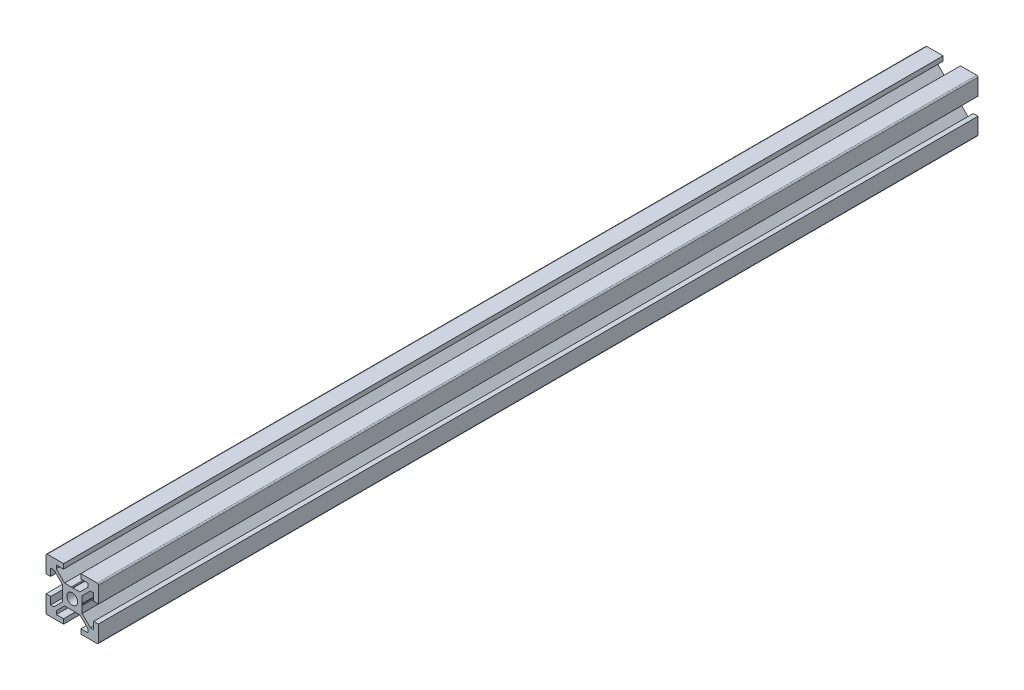
from build123d import *
from build123d.topology import SkipClean

# Parameters (mm, degrees)
SKETCH1_R            = 2.05
BOSS_EXTRUDE1_DEPTH  = 157.75
FILLET1_R            = 0.5
SKETCH2_R            = 2.75
CUT_EXTRUDE1_DEPTH   = 160.326904508
FILLET1_OF_MIRROR1_R = 0.5
SKETCH3_R            = 2.05
BOSS_EXTRUDE2_DEPTH  = 20


with BuildPart() as part:
    # Sketch1 → Boss-Extrude1 (new body)
    with BuildSketch(Plane.XY):
        Polygon((-3.3, 10), (-3.3, 8.2), (-6.08, 8.2), (-6.08, 6.928528137), (-2.931471863, 3.78), (-0.34, 3.78), (0, 3.66), (0.34, 3.78), (2.931471863, 3.78), (6.08, 6.928528137), (6.08, 8.2), (3.3, 8.2), (3.3, 10), (10, 10), (10, 3.3), (8.2, 3.3), (8.2, 6.08), (6.928528137, 6.08), (3.78, 2.931471863), (3.78, 0.34), (3.66, 0), (3.78, -0.34), (3.78, -2.931471863), (6.928528137, -6.08), (8.2, -6.08), (8.2, -3.3), (10, -3.3), (10, -10), (3.3, -10), (3.3, -8.2), (6.08, -8.2), (6.08, -6.928528137), (2.931471863, -3.78), (0.34, -3.78), (0, -3.66), (-0.34, -3.78), (-2.931471863, -3.78), (-6.08, -6.928528137), (-6.08, -8.2), (-3.3, -8.2), (-3.3, -10), (-10, -10), (-10, -3.3), (-8.2, -3.3), (-8.2, -6.08), (-6.928528137, -6.08), (-3.78, -2.931471863), (-3.78, -0.34), (-3.66, 0), (-3.78, 0.34), (-3.78, 2.931471863), (-6.928528137, 6.08), (-8.2, 6.08), (-8.2, 3.3), (-10, 3.3), (-10, 10), align=None)
        Circle(SKETCH1_R, mode=Mode.SUBTRACT)
    boss_extrude1 = extrude(amount=BOSS_EXTRUDE1_DEPTH)

    # Fillet1
    fillet1_edges = [part.edges().sort_by_distance(p)[0] for p in [
        (10, 10, 78.875),
        (10, -10, 78.875),
        (-10, -10, 78.875),
        (-10, 10, 78.875),
    ]]
    fillet(fillet1_edges, radius=FILLET1_R)

    # Sketch2 → Cut-Extrude1 (cut, through all)
    with BuildSketch(Plane.XZ.offset(10)):
        with Locations(Location((0, 11.75, 0), (0, 0, 277.102014322))):
            Circle(SKETCH2_R)
    cut_extrude1 = extrude(amount=-CUT_EXTRUDE1_DEPTH, mode=Mode.SUBTRACT)

    # Mirror1: Boss-Extrude1, Cut-Extrude1 across plane
    add(boss_extrude1.mirror(Plane.XY.offset(157.75)))
    add(cut_extrude1.mirror(Plane.XY.offset(157.75)), mode=Mode.SUBTRACT)

    # Fillet1 of Mirror1
    fillet1_of_mirror1_edges = [part.edges().sort_by_distance(p)[0] for p in [
        (10, 10, 236.625),
        (10, -10, 236.625),
        (-10, -10, 236.625),
        (-10, 10, 236.625),
    ]]
    fillet(fillet1_of_mirror1_edges, radius=FILLET1_OF_MIRROR1_R)

    # Sketch3 → Boss-Extrude2 (add)
    with SkipClean():  # the faces are left unmerged after this step: merging them gives an invalid solid
        with BuildSketch(Plane.XY.offset(315.5)):
            with BuildLine():
                Line((-3.3, 10), (-9.5, 10))
                ThreePointArc((-9.5, 10), (-9.853553391, 9.853553391), (-10, 9.5))
                Line((-10, 9.5), (-10, 3.3))
                Line((-10, 3.3), (-8.2, 3.3))
                Line((-8.2, 3.3), (-8.2, 6.08))
                Line((-8.2, 6.08), (-6.928528137, 6.08))
                Line((-6.928528137, 6.08), (-3.78, 2.931471863))
                Line((-3.78, 2.931471863), (-3.78, 0.34))
                Line((-3.78, 0.34), (-3.66, 0))
                Line((-3.66, 0), (-3.78, -0.34))
                Line((-3.78, -0.34), (-3.78, -2.931471863))
                Line((-3.78, -2.931471863), (-6.928528137, -6.08))
                Line((-6.928528137, -6.08), (-8.2, -6.08))
                Line((-8.2, -6.08), (-8.2, -3.3))
                Line((-8.2, -3.3), (-10, -3.3))
                Line((-10, -3.3), (-10, -9.5))
                ThreePointArc((-10, -9.5), (-9.853553391, -9.853553391), (-9.5, -10))
                Line((-9.5, -10), (-3.3, -10))
                Line((-3.3, -10), (-3.3, -8.2))
                Line((-3.3, -8.2), (-6.08, -8.2))
                Line((-6.08, -8.2), (-6.08, -6.928528137))
                Line((-6.08, -6.928528137), (-2.931471863, -3.78))
                Line((-2.931471863, -3.78), (-0.34, -3.78))
                Line((-0.34, -3.78), (0, -3.66))
                Line((0, -3.66), (0.34, -3.78))
                Line((0.34, -3.78), (2.931471863, -3.78))
                Line((2.931471863, -3.78), (6.08, -6.928528137))
                Line((6.08, -6.928528137), (6.08, -8.2))
                Line((6.08, -8.2), (3.3, -8.2))
                Line((3.3, -8.2), (3.3, -10))
                Line((3.3, -10), (9.5, -10))
                ThreePointArc((9.5, -10), (9.853553391, -9.853553391), (10, -9.5))
                Line((10, -9.5), (10, -3.3))
                Line((10, -3.3), (8.2, -3.3))
                Line((8.2, -3.3), (8.2, -6.08))
                Line((8.2, -6.08), (6.928528137, -6.08))
                Line((6.928528137, -6.08), (3.78, -2.931471863))
                Line((3.78, -2.931471863), (3.78, -0.34))
                Line((3.78, -0.34), (3.66, 0))
                Line((3.66, 0), (3.78, 0.34))
                Line((3.78, 0.34), (3.78, 2.931471863))
                Line((3.78, 2.931471863), (6.928528137, 6.08))
                Line((6.928528137, 6.08), (8.2, 6.08))
                Line((8.2, 6.08), (8.2, 3.3))
                Line((8.2, 3.3), (10, 3.3))
                Line((10, 3.3), (10, 9.5))
                ThreePointArc((10, 9.5), (9.853553391, 9.853553391), (9.5, 10))
                Line((9.5, 10), (3.3, 10))
                Line((3.3, 10), (3.3, 8.2))
                Line((3.3, 8.2), (6.08, 8.2))
                Line((6.08, 8.2), (6.08, 6.928528137))
                Line((6.08, 6.928528137), (2.931471863, 3.78))
                Line((2.931471863, 3.78), (0.34, 3.78))
                Line((0.34, 3.78), (0, 3.66))
                Line((0, 3.66), (-0.34, 3.78))
                Line((-0.34, 3.78), (-2.931471863, 3.78))
                Line((-2.931471863, 3.78), (-6.08, 6.928528137))
                Line((-6.08, 6.928528137), (-6.08, 8.2))
                Line((-6.08, 8.2), (-3.3, 8.2))
                Line((-3.3, 8.2), (-3.3, 10))
            make_face()
            with Locations(Location((0, 0, 0), (0, 0, 180))):
                Circle(SKETCH3_R, mode=Mode.SUBTRACT)
        extrude(amount=BOSS_EXTRUDE2_DEPTH)


solid = part.part
